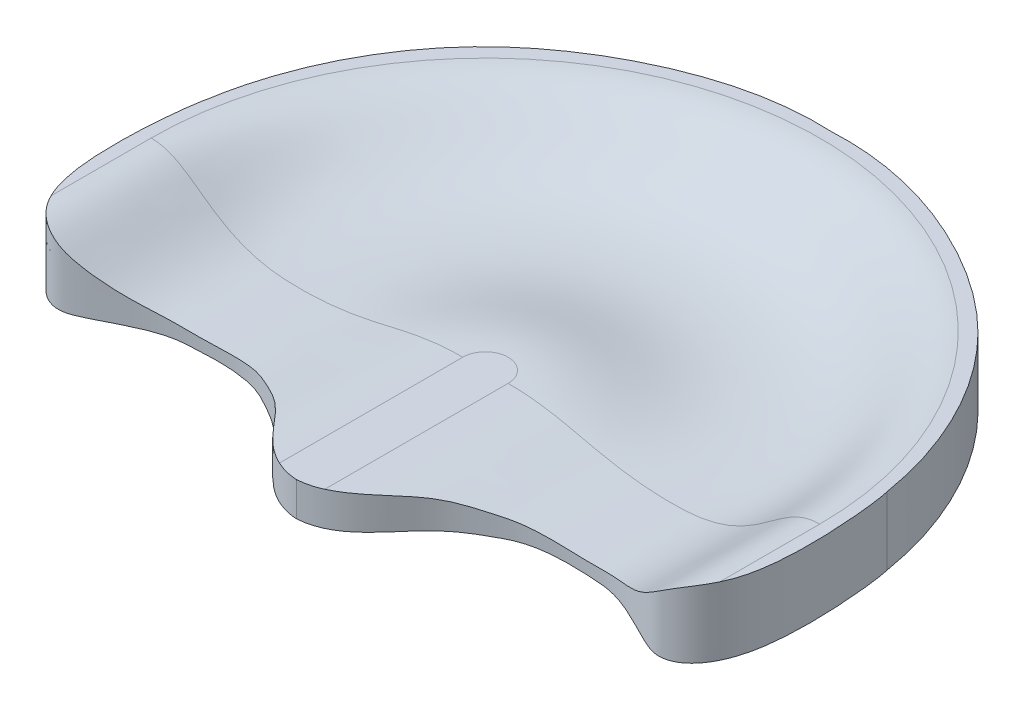
from build123d import *

# Parameters (mm, degrees)
BOSS_EXTRUDE1_DEPTH         = 6.35
F_1_4_0_25_DIAMETER_HOLE1_D = 6.35
CUT_EXTRUDE3_DEPTH          = 257.844790723
BOSS_EXTRUDE2_START         = 31.75
BOSS_EXTRUDE2_DEPTH         = 31.75
BOSS_EXTRUDE3_DEPTH         = 12.7


with BuildPart() as part:
    # Sketch3 → Boss-Extrude1 (new body)
    with BuildSketch(Plane(origin=(0, 0, 0), x_dir=(1, 0, 0), z_dir=(0, 1, 0))):
        with BuildLine():
            add(Edge.make_bspline(
                [(-190.5, 0), (-184.392726562, 37.537038237), (-157.261289847, 93.964093485), (-82.387478202, 146.622658841), (-31.311374143, 160.799884185), (0, 159.189909928)],
                knots=[0, 0, 0, 0, 0.424401366, 0.656369581, 1, 1, 1, 1], degree=3))
            add(Edge.make_bspline(
                [(190.5, 0), (184.392726562, 37.537038237), (157.261289847, 93.964093485), (82.387478202, 146.622658841), (31.311374143, 160.799884185), (0, 159.189909928)],
                knots=[0, 0, 0, 0, 0.424401366, 0.656369581, 1, 1, 1, 1], degree=3))
            add(Edge.make_bspline(
                [(190.5, 0), (192.064011793, -4.963501926), (201.967167766, -83.314618311), (174.696602041, -109.289958804), (151.630121659, -100.567984898), (131.410771519, -87.719783961), (96.843567628, -85.375403377), (78.692510144, -86.25882742), (58.833533072, -96.87938247), (37.30593461, -109.935798162), (21.349613946, -139.114767457), (0, -140.530090072)],
                knots=[0, 0, 0, 0, 0.166997052, 0.292320514, 0.319633117, 0.42673531, 0.45891405, 0.609241775, 0.641909704, 0.76680237, 1, 1, 1, 1], degree=3))
            add(Edge.make_bspline(
                [(-190.5, 0), (-192.064011793, -4.963501926), (-201.967167766, -83.314618311), (-174.696602041, -109.289958804), (-151.630121659, -100.567984898), (-131.410771519, -87.719783961), (-96.843567628, -85.375403377), (-78.692510144, -86.25882742), (-58.833533072, -96.87938247), (-37.30593461, -109.935798162), (-21.349613946, -139.114767457), (0, -140.530090072)],
                knots=[0, 0, 0, 0, 0.166997052, 0.292320514, 0.319633117, 0.42673531, 0.45891405, 0.609241775, 0.641909704, 0.76680237, 1, 1, 1, 1], degree=3))
        make_face()
    extrude(amount=BOSS_EXTRUDE1_DEPTH)

    # 1/4 (0.25) Diameter Hole1 (through all)
    with Locations(Plane(origin=(0, 0, 0), x_dir=(-1, 0, 0), z_dir=(0, -1, 0))):
        with Locations((-25.4, 45.72), (25.4, 45.72), (25.4, -5.08), (-25.4, -5.08)):
            Hole(F_1_4_0_25_DIAMETER_HOLE1_D / 2)

    # Sweep3: sweep along a path in Sketch9
    with BuildLine(Plane(origin=(0, 6.35, 0), x_dir=(1, 0, 0), z_dir=(0, 1, 0))) as sweep3_path:
        Line((-187.357021454, -163.355137278), (-187.357021454, -34.517111526))
        ThreePointArc((-187.357021454, -34.517111526), (0, 152.839909928), (187.357021454, -34.517111526))
        Line((187.357021454, -34.517111526), (187.357021454, -159.794446851))
    # Sketch14 → Sweep3 (sweep)
    with BuildSketch(Plane.XY.offset(159.794446851)):
        with BuildLine():
            Line((187.357021454, 6.35), (187.357021454, 38.1))
            add(Edge.make_bspline(
                [(12.7, 19.05), (43.942, 19.05), (62.692965612, 6.892995609), (152.966881442, 6.044529769), (164.497021454, 38.1), (187.357021454, 38.1)],
                knots=[0, 0, 0, 0, 0.419037708, 0.519037708, 1, 1, 1, 1], degree=3))
            Line((12.7, 19.05), (12.7, 6.35))
            Line((12.7, 6.35), (187.357021454, 6.35))
        make_face()
    sweep(path=sweep3_path.line)

    # Sketch16 → Cut-Extrude3 (cut, through all)
    with BuildSketch(Plane.XZ):
        with BuildLine():
            Line((-187.357021454, 163.355137278), (-187.357021454, 90.603010601))
            add(Edge.make_bspline(
                [(-187.357021454, 90.603010601), (-182.022531897, 101.456727274), (-171.744921629, 108.173859638), (-151.630121659, 100.567984898), (-131.410771519, 87.719783961), (-96.843567628, 85.375403377), (-78.692510144, 86.25882742), (-58.833533072, 96.87938247), (-40.149019421, 108.211476835), (-26.027042678, 131.062023831), (-12.7, 137.276352827)],
                knots=[0.200234213, 0.200234213, 0.200234213, 0.200234213, 0.292320514, 0.319633117, 0.42673531, 0.45891405, 0.609241775, 0.641909704, 0.76680237, 0.948393743, 0.948393743, 0.948393743, 0.948393743], degree=3))
            Line((-12.7, 137.276352827), (-12.7, 163.355137278))
            Line((-12.7, 163.355137278), (-187.357021454, 163.355137278))
        make_face()
        with BuildLine():
            Line((12.7, 159.794446851), (12.7, 137.276352827))
            add(Edge.make_bspline(
                [(12.7, 137.276352827), (26.027042678, 131.062023831), (40.149019421, 108.211476835), (58.833533072, 96.87938247), (78.692510144, 86.25882742), (96.843567628, 85.375403377), (131.410771519, 87.719783961), (151.630121659, 100.567984898), (171.744921629, 108.173859638), (182.022531897, 101.456727274), (187.357021459, 90.603010604)],
                knots=[0.051606257, 0.051606257, 0.051606257, 0.051606257, 0.23319763, 0.358090296, 0.390758225, 0.54108595, 0.57326469, 0.680366883, 0.707679486, 0.799765787, 0.799765787, 0.799765787, 0.799765787], degree=3))
            Line((187.357021459, 90.603010604), (187.357021454, 159.794446851))
            Line((187.357021454, 159.794446851), (12.7, 159.794446851))
        make_face()
    extrude(amount=-CUT_EXTRUDE3_DEPTH, mode=Mode.SUBTRACT)

    # Sketch18 → Boss-Extrude2 (add)
    with BuildSketch(Plane(origin=(0, 6.35, 0), x_dir=(1, 0, 0), z_dir=(0, 1, 0)).offset(BOSS_EXTRUDE2_START)):
        with BuildLine():
            Line((-187.357021454, -90.603010614), (-187.357021454, -34.517111526))
            ThreePointArc((-187.357021454, -34.517111526), (0, 152.839909928), (187.357021454, -34.517111526))
            Line((187.357021454, -34.517111526), (187.357021459, -90.603010604))
            add(Edge.make_bspline(
                [(187.357021459, -90.603010604), (189.282425006, -86.68552528), (198.847492761, -58.632585631), (192.064011793, -4.963501926), (190.5, 0)],
                knots=[0.799765787, 0.799765787, 0.799765787, 0.799765787, 0.833002948, 1, 1, 1, 1], degree=3))
            add(Edge.make_bspline(
                [(190.5, 0), (184.392726562, 37.537038237), (157.261289847, 93.964093485), (82.387478202, 146.622658841), (31.311374143, 160.799884185), (0, 159.189909928)],
                knots=[0, 0, 0, 0, 0.424401366, 0.656369581, 1, 1, 1, 1], degree=3))
            add(Edge.make_bspline(
                [(0, 159.189909928), (-31.311374143, 160.799884185), (-82.387478202, 146.622658841), (-157.261289847, 93.964093485), (-184.392726562, 37.537038237), (-190.5, 0)],
                knots=[0, 0, 0, 0, 0.343630419, 0.575598634, 1, 1, 1, 1], degree=3))
            add(Edge.make_bspline(
                [(-190.5, 0), (-192.064011793, -4.963501926), (-198.847492762, -58.63258564), (-189.282425003, -86.685525289), (-187.357021454, -90.603010614)],
                knots=[0, 0, 0, 0, 0.166997052, 0.200234213, 0.200234213, 0.200234213, 0.200234213], degree=3))
        make_face()
    extrude(amount=-BOSS_EXTRUDE2_DEPTH)

    # Sketch20 → Boss-Extrude3 (add)
    with BuildSketch(Plane(origin=(0, 6.35, 0), x_dir=(1, 0, 0), z_dir=(0, 1, 0))):
        with BuildLine():
            Line((-12.7, -34.517111526), (-12.7, -137.276352827))
            add(Edge.make_bspline(
                [(-12.7, -137.276352827), (-8.912602093, -139.042396293), (-4.724634894, -140.216881476), (0, -140.530090072)],
                knots=[0.948393743, 0.948393743, 0.948393743, 0.948393743, 1, 1, 1, 1], degree=3))
            add(Edge.make_bspline(
                [(0, -140.530090072), (4.724634894, -140.216881476), (8.912602093, -139.042396293), (12.7, -137.276352827)],
                knots=[0, 0, 0, 0, 0.051606257, 0.051606257, 0.051606257, 0.051606257], degree=3))
            Line((12.7, -137.276352827), (12.7, -34.517111526))
            ThreePointArc((12.7, -34.517111526), (0, -21.817111526), (-12.7, -34.517111526))
        make_face()
    extrude(amount=BOSS_EXTRUDE3_DEPTH)


solid = part.part
